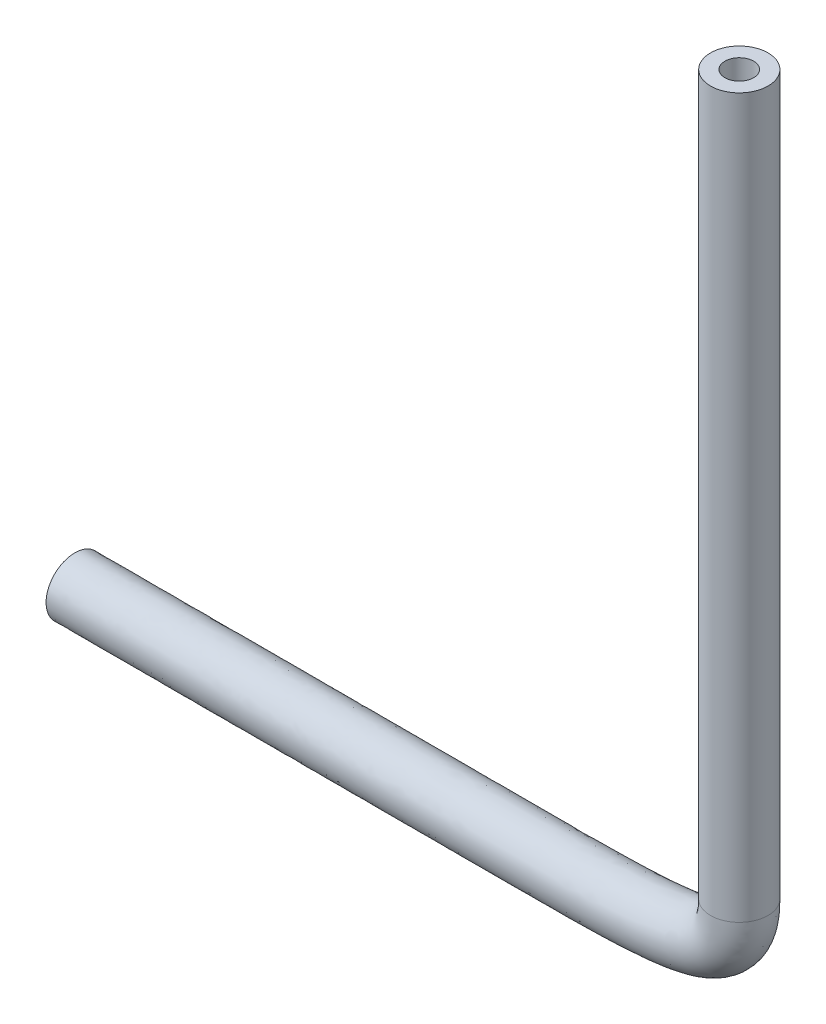
from build123d import *

# Parameters (mm, degrees)
PIPERING_R   = 0.8
PIPERING_R_2 = 0.4


with BuildPart() as part:
    # Pipe: sweep along a path in PipeSke
    with BuildLine() as pipe_path:  # in the path sketch's own coordinates; laid on its plane below (add() does not lay a ready-made edge on the line's plane)
        Line((-12.5, 0), (0, 0))
        add(Edge.make_bspline(
            [(0, 0), (4.619948081, 0), (6, 0.035966381), (6, 1.704499781)],
            knots=[0, 0, 0, 0, 1, 1, 1, 1], degree=3))
        Line((6, 1.704499781), (6, 21.704499781))
    # PipeRing → Pipe (sweep)
    with BuildSketch(Plane(origin=(0, 0, 0), x_dir=(0, 0, -1), z_dir=(1, 0, 0))):
        Circle(PIPERING_R)
        Circle(PIPERING_R_2, mode=Mode.SUBTRACT)
    sweep(path=Plane.XY * pipe_path.line)


solid = part.part
